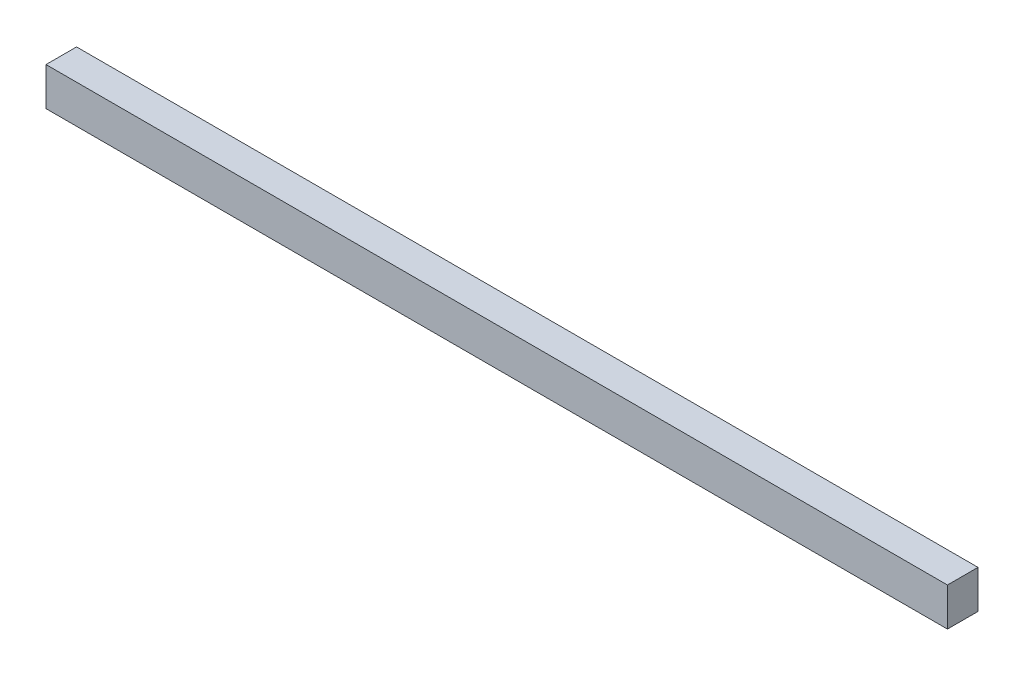
from build123d import *

# Parameters (mm, degrees)
FKAP_CERCEVE_ALT_1_START = 20
SKETCH1_W                = 590
SKETCH1_H                = 25
FKAP_CERCEVE_ALT_1_DEPTH = 20


with BuildPart() as part:
    # Sketch1 → FKAP_cerceve_alt_1 (new body)
    with BuildSketch(Plane.XY.offset(FKAP_CERCEVE_ALT_1_START)):
        with Locations((320, 12.5)):
            Rectangle(SKETCH1_W, SKETCH1_H)
    extrude(amount=FKAP_CERCEVE_ALT_1_DEPTH)


solid = part.part
